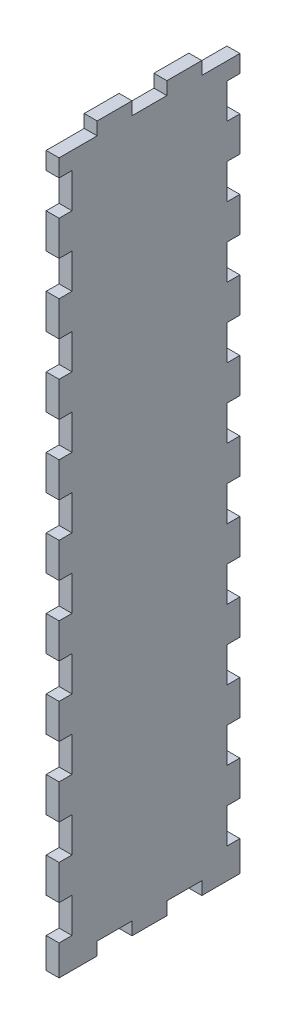
from build123d import *

# Parameters (mm, degrees)
BOSS_EXTRUDE1_DEPTH = 6.35


with BuildPart() as part:
    # Sketch1 → Boss-Extrude1 (new body)
    with BuildSketch(Plane(origin=(0, 0, 0), x_dir=(0, 0, -1), z_dir=(1, 0, 0))):
        Polygon((0, 14.9225), (0, 6.35), (0, 0), (6.35, 0), (18.7325, 0), (18.7325, 6.35), (35.8775, 6.35), (35.8775, 0), (53.0225, 0), (53.0225, 6.35), (70.1675, 6.35), (70.1675, 0), (82.55, 0), (88.9, 0), (88.9, 6.35), (88.9, 14.9225), (82.55, 14.9225), (82.55, 32.0675), (88.9, 32.0675), (88.9, 49.2125), (82.55, 49.2125), (82.55, 66.3575), (88.9, 66.3575), (88.9, 83.5025), (82.55, 83.5025), (82.55, 100.6475), (88.9, 100.6475), (88.9, 117.7925), (82.55, 117.7925), (82.55, 134.9375), (88.9, 134.9375), (88.9, 152.0825), (82.55, 152.0825), (82.55, 169.2275), (88.9, 169.2275), (88.9, 186.3725), (82.55, 186.3725), (82.55, 203.5175), (88.9, 203.5175), (88.9, 220.6625), (82.55, 220.6625), (82.55, 237.8075), (88.9, 237.8075), (88.9, 254.9525), (82.55, 254.9525), (82.55, 272.0975), (88.9, 272.0975), (88.9, 289.2425), (82.55, 289.2425), (82.55, 306.3875), (88.9, 306.3875), (88.9, 323.5325), (82.55, 323.5325), (82.55, 340.6775), (88.9, 340.6775), (88.9, 349.25), (70.1675, 349.25), (70.1675, 355.6), (53.0225, 355.6), (53.0225, 349.25), (35.8775, 349.25), (35.8775, 355.6), (18.7325, 355.6), (18.7325, 349.25), (6.35, 349.25), (0, 349.25), (0, 340.6775), (6.35, 340.6775), (6.35, 334.518000001), (6.35, 329.692000001), (6.35, 323.5325), (0, 323.5325), (0, 306.3875), (6.35, 306.3875), (6.35, 289.2425), (0, 289.2425), (0, 272.0975), (6.35, 272.0975), (6.35, 254.9525), (0, 254.9525), (0, 237.8075), (6.35, 237.8075), (6.35, 220.6625), (0, 220.6625), (0, 203.5175), (6.35, 203.5175), (6.35, 186.3725), (0, 186.3725), (0, 169.2275), (6.35, 169.2275), (6.35, 152.0825), (0, 152.0825), (0, 134.9375), (6.35, 134.9375), (6.35, 117.7925), (0, 117.7925), (0, 100.6475), (6.35, 100.6475), (6.35, 83.5025), (0, 83.5025), (0, 66.3575), (6.35, 66.3575), (6.35, 49.2125), (0, 49.2125), (0, 32.0675), (6.35, 32.0675), (6.35, 25.907999999), (6.35, 21.081999999), (6.35, 14.9225), align=None)
    extrude(amount=BOSS_EXTRUDE1_DEPTH)


solid = part.part
